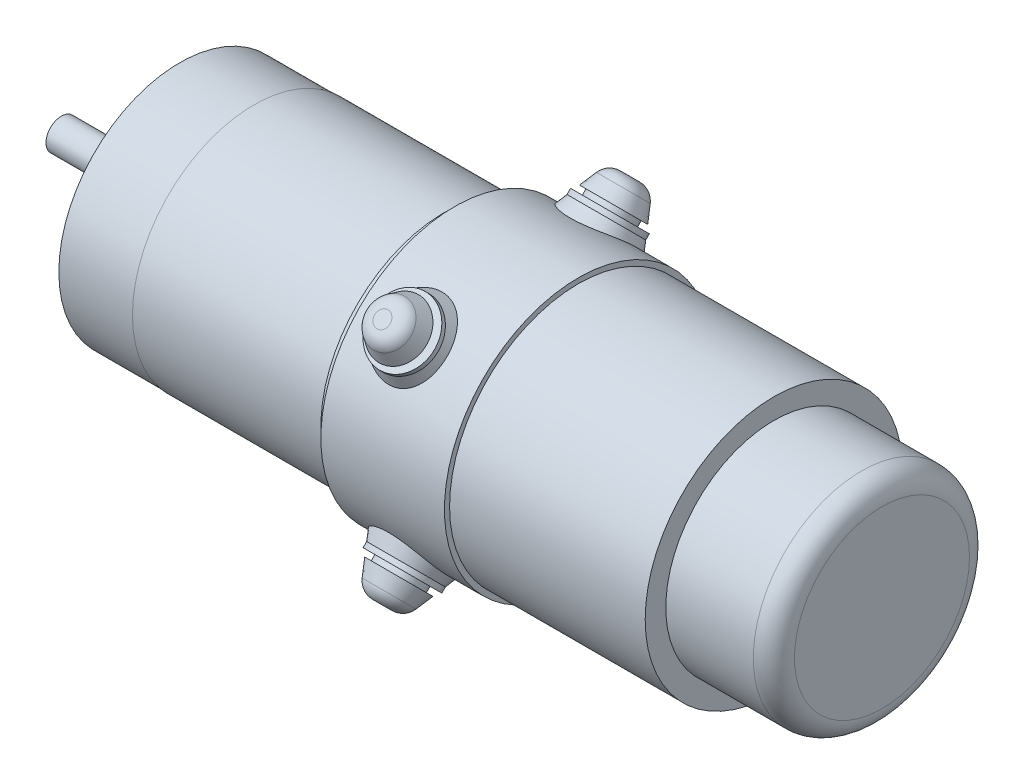
from build123d import *

# Parameters (mm, degrees)
BOSS_EXTRU_2_REACH                 = 176.404
BOSS_EXTRU_2_END_RADIUS            = 26
ESQUISSE3_R                        = 3.5
BOSS_EXTRU_2_DRAFT                 = 23
CONG_1_R                           = 3
BOSS_EXTRU_3_REACH                 = 174.245
ESQUISSE4_R                        = 6.25
ESQUISSE5_R                        = 5.834611489
ESQUISSE5_R_2                      = 4.38
ENL_V_MAT_EXTRU_1_DEPTH            = 1
R_P_TITION_CIRCULAIRE1_COUNT       = 4
CONG_1_OF_R_P_TITION_CIRCULAIRE1_R = 3
R_P_TITION_CIRCULAIRE2_COUNT       = 4


with BuildPart() as part:
    # Esquisse1 → Base-Révolution (revolve)
    with BuildSketch(Plane.XY, mode=Mode.PRIVATE) as base_r_volution_sk:
        with BuildLine():
            Line((0, 0), (0, 17))
            ThreePointArc((0, 17), (-1.171572875, 19.828427125), (-4, 21))
            Line((-4, 21), (-21, 21))
            Line((-21, 21), (-21, 25))
            Line((-21, 25), (-59, 25))
            Line((-59, 25), (-59, 26))
            Line((-59, 26), (-83, 26))
            Line((-83, 26), (-83, 24))
            Line((-83, 24), (-85, 24))
            Line((-85, 24), (-85, 23.6))
            Line((-85, 23.6), (-122, 23.6))
            Line((-122, 23.6), (-122, 23.5))
            Line((-122, 23.5), (-136.4, 23.5))
            Line((-136.4, 23.5), (-136.4, 12.5))
            Line((-136.4, 12.5), (-139.4, 12.5))
            Line((-139.4, 12.5), (-139.4, 3))
            Line((-139.4, 3), (-159.4, 3))
            Line((-159.4, 3), (-159.4, 0))
            Line((-159.4, 0), (-134.247535453, 0))
            Line((-134.247535453, 0), (-134.247535453, 21))
            Line((-134.247535453, 21), (-24.682142699, 21))
            Line((-24.682142699, 21), (-24.682142699, 17))
            Line((-24.682142699, 17), (-4.229936052, 17))
            Line((-4.229936052, 17), (-4.229936052, 0))
            Line((-4.229936052, 0), (0, 0))
        make_face()
    revolve(base_r_volution_sk.sketch.rotate(Axis((0, 0, 0), (-1, 0, 0)), 90), axis=Axis((0, 0, 0), (-1, 0, 0)))

    # Boss.-Extru.2: up to this cylinder (the profile starts outside it)
    boss_extru_2_end = Plane(origin=(-73, 0, 0), z_dir=(1, 0, 0)) * Cylinder(BOSS_EXTRU_2_END_RADIUS, 405.808, mode=Mode.PRIVATE)



with BuildPart() as boss_extru_2_long_prism_1:
    # Esquisse3 → Boss.-Extru.2 (the long prism of profile 1, to be tilted and cut off)
    with BuildSketch(Plane(origin=(0, 24.04163056, 24.04163056), x_dir=(-1, 0, 0), z_dir=(0, 0.7071067811865488, 0.7071067811865462))):
        with Locations((73, 0)):
            Circle(ESQUISSE3_R)
    extrude(amount=-BOSS_EXTRU_2_REACH)
    boss_extru_2_tool1_sides = [boss_extru_2_long_prism_1.faces().sort_by_distance(p)[0] for p in [
        (-69.5, -38.326601754, -38.326601754),
    ]]
    draft(boss_extru_2_tool1_sides, Plane(origin=(0, 24.04163056, 24.04163056), x_dir=(-1, 0, 0), z_dir=(0, 0.7071067811865488, 0.7071067811865462)), BOSS_EXTRU_2_DRAFT)  # the draft: side faces tilted about the start plane


with BuildPart() as part_1:
    add(part.part)
    boss_extru_2_tool1 = boss_extru_2_long_prism_1.part - boss_extru_2_end
    boss_extru_2 = boss_extru_2_tool1.solids().sort_by_distance((-73, 24.041631, 24.041631))[0]
    add(boss_extru_2)

    # Congé1
    cong_1_edges = [part_1.edges().sort_by_distance(p)[0] for p in [
        (-69.5, 24.04163056, 24.04163056),
    ]]
    fillet(cong_1_edges, radius=CONG_1_R)

    # Esquisse4 → Boss.-Extru.3 (add, up to next)
    with BuildSketch(Plane(origin=(0, 20.152543264, 20.152543264), x_dir=(-1, 0, 0), z_dir=(0, 0.7071067811865488, 0.7071067811865462)), mode=Mode.PRIVATE) as boss_extru_3_sk1:
        with Locations(Location((73, 0, 0), (0, 0, 90))):
            Circle(ESQUISSE4_R)
    boss_extru_3_tool1 = extrude(boss_extru_3_sk1.sketch, amount=-BOSS_EXTRU_3_REACH, mode=Mode.PRIVATE) - part_1.part
    boss_extru_3 = boss_extru_3_tool1.solids().sort_by_distance((-73, 20.152543, 20.152543))[0]
    add(boss_extru_3)

    # Esquisse5 → Enlèv. mat.-Extru.1 (cut)
    with BuildSketch(Plane(origin=(0, 20.152543264, 20.152543264), x_dir=(-1, 0, 0), z_dir=(0, 0.7071067811865488, 0.7071067811865462))):
        with Locations((73, 0)):
            Circle(ESQUISSE5_R)
        with Locations(Location((73, 0, 0), (0, 0, 90))):
            Circle(ESQUISSE5_R_2, mode=Mode.SUBTRACT)
    enl_v_mat_extru_1 = extrude(amount=ENL_V_MAT_EXTRU_1_DEPTH, mode=Mode.SUBTRACT)

    # Répétition circulaire1: Boss.-Extru.2, Boss.-Extru.3, Enlèv. mat.-Extru.1 ×4 about axis
    r_p_tition_circulaire1_axis = Axis((0, 0, 0), (1, 0, 0))
    add([boss_extru_2.rotate(r_p_tition_circulaire1_axis, i * 360 / R_P_TITION_CIRCULAIRE1_COUNT) for i in range(1, R_P_TITION_CIRCULAIRE1_COUNT)])
    add([boss_extru_3.rotate(r_p_tition_circulaire1_axis, i * 360 / R_P_TITION_CIRCULAIRE1_COUNT) for i in range(1, R_P_TITION_CIRCULAIRE1_COUNT)])
    add([enl_v_mat_extru_1.rotate(r_p_tition_circulaire1_axis, i * 360 / R_P_TITION_CIRCULAIRE1_COUNT) for i in range(1, R_P_TITION_CIRCULAIRE1_COUNT)], mode=Mode.SUBTRACT)

    # Congé1 of Répétition circulaire1
    cong_1_of_r_p_tition_circulaire1_edges = [part_1.edges().sort_by_distance(p)[0] for p in [
        (-69.5, -24.04163056, 24.04163056),
        (-69.5, -24.04163056, -24.04163056),
        (-69.5, 24.04163056, -24.04163056),
    ]]
    fillet(cong_1_of_r_p_tition_circulaire1_edges, radius=CONG_1_OF_R_P_TITION_CIRCULAIRE1_R)

    # Esquisse6 → Trou taraudé M41 (revolve, cut)
    with BuildSketch(Plane(origin=(-136.4, 12.727922061, 12.727922061), x_dir=(0, 0, 1), z_dir=(0, 1, 0))):
        Polygon((0, 0), (0, 9.491420021), (1.65, 8.5), (1.65, 0), align=None)
    trou_taraud_m41 = revolve(axis=Axis((-142.75, 12.727922061, 12.727922061), (1, 0, 0)), mode=Mode.SUBTRACT)

    # Répétition circulaire2: Trou taraudé M41 ×4 about axis
    r_p_tition_circulaire2_axis = Axis((0, 0, 0), (1, 0, 0))
    for i in range(1, R_P_TITION_CIRCULAIRE2_COUNT):
        add(trou_taraud_m41.rotate(r_p_tition_circulaire2_axis, i * 360 / R_P_TITION_CIRCULAIRE2_COUNT), mode=Mode.SUBTRACT)


solid = part_1.part
